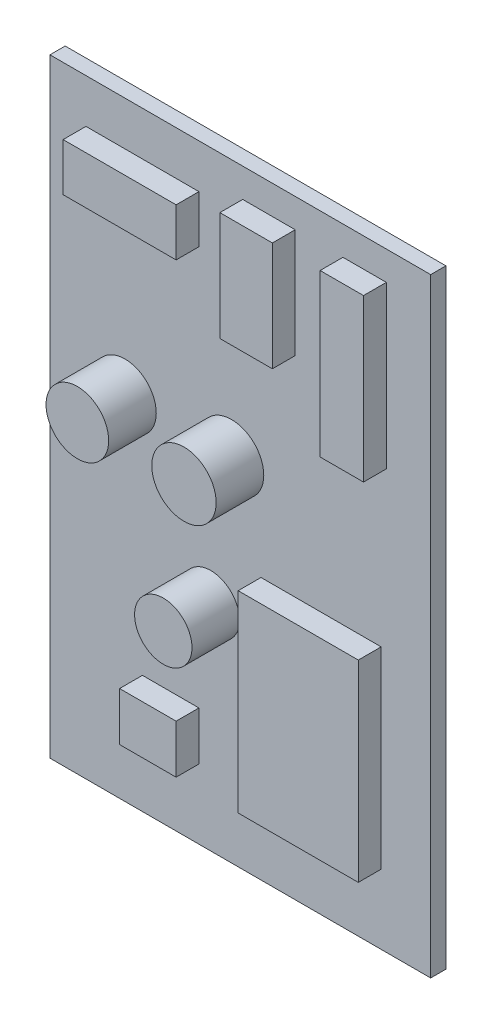
from build123d import *

# Parameters (mm, degrees)
SKETCH1_W           = 25.4
SKETCH1_H           = 40.64
BOSS_EXTRUDE1_DEPTH = 1.016
SKETCH4_R           = 2.089194207
SKETCH4_R_2         = 2.147685622
SKETCH4_R_3         = 1.913924405
BOSS_EXTRUDE3_DEPTH = 3.175
SKETCH3_W           = 2.894795888
SKETCH3_H           = 10.775790564
SKETCH3_W_2         = 3.503459001
SKETCH3_H_2         = 7.272331563
SKETCH3_W_3         = 7.537745123
SKETCH3_H_3         = 3.184962728
SKETCH3_W_4         = 3.768872561
SKETCH3_H_4         = 3.23804544
SKETCH3_W_5         = 8.015489533
SKETCH3_H_5         = 12.846016337
BOSS_EXTRUDE2_DEPTH = 2.54


with BuildPart() as part:
    # Sketch1 → Boss-Extrude1 (new body)
    with BuildSketch(Plane.XY):
        with Locations((-9.742465753, -2.835753425)):
            Rectangle(SKETCH1_W, SKETCH1_H)
    extrude(amount=BOSS_EXTRUDE1_DEPTH)

    # Sketch4 → Boss-Extrude3 (add)
    with BuildSketch(Plane.XY.offset(1.016)):
        with Locations((-17.439459013, 0.322667948)):
            Circle(SKETCH4_R)
        with Locations((-10.326375587, 0.322667948)):
            Circle(SKETCH4_R_2)
        with Locations((-11.706526103, -8.860641252)):
            Circle(SKETCH4_R_3)
    extrude(amount=BOSS_EXTRUDE3_DEPTH)

    # Sketch3 → Boss-Extrude2 (add)
    with BuildSketch(Plane.XY):
        with Locations((-1.447397944, 10.169511049)):
            Rectangle(SKETCH3_W, SKETCH3_H)
        with Locations((-7.831488117, 11.92124055)):
            Rectangle(SKETCH3_W_2, SKETCH3_H_2)
        with Locations((-16.271639347, 12.956353436)):
            Rectangle(SKETCH3_W_3, SKETCH3_H_3)
        with Locations((-14.387203065, -16.902672141)):
            Rectangle(SKETCH3_W_4, SKETCH3_H_4)
        with Locations((-4.354570472, -12.098686692)):
            Rectangle(SKETCH3_W_5, SKETCH3_H_5)
    extrude(amount=BOSS_EXTRUDE2_DEPTH)


solid = part.part
